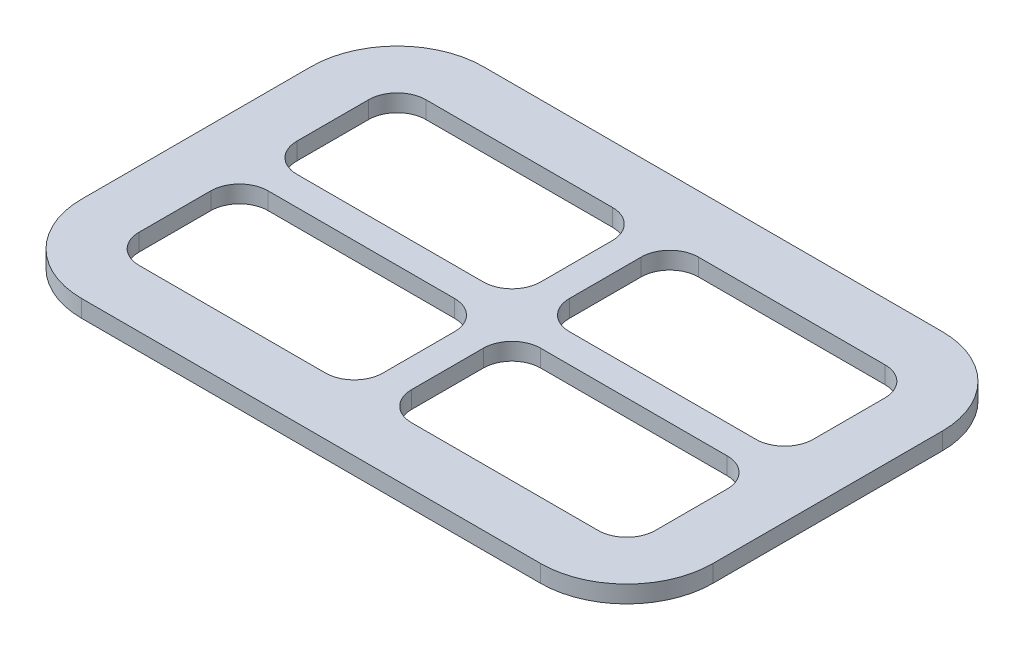
from build123d import *

# Parameters (mm, degrees)
ESBO_O1_W                = 220
ESBO_O1_H                = 140
RESSALTO_EXTRUS_O1_DEPTH = 6
ESBO_O2_W                = 85
ESBO_O2_H                = 45
CORTE_EXTRUS_O1_DEPTH    = 6
FILETE1_R                = 30
FILETE2_R                = 10


with BuildPart() as part:
    # Esboço1 → Ressalto-extrusão1 (new body)
    with BuildSketch(Plane(origin=(0, 0, 0), x_dir=(1, 0, 0), z_dir=(0, 1, 0))):
        Rectangle(ESBO_O1_W, ESBO_O1_H)
    extrude(amount=RESSALTO_EXTRUS_O1_DEPTH)

    # Esboço2 → Corte-extrusão1 (cut)
    with BuildSketch(Plane(origin=(0, 6, 0), x_dir=(1, 0, 0), z_dir=(0, 1, 0))):
        with Locations((47.5, 27.5)):
            Rectangle(ESBO_O2_W, ESBO_O2_H)
        with Locations((-47.5, 27.5)):
            Rectangle(ESBO_O2_W, ESBO_O2_H)
        with Locations((-47.5, -27.5)):
            Rectangle(ESBO_O2_W, ESBO_O2_H)
        with Locations((47.5, -27.5)):
            Rectangle(ESBO_O2_W, ESBO_O2_H)
    extrude(amount=-CORTE_EXTRUS_O1_DEPTH, mode=Mode.SUBTRACT)

    # Filete1
    filete1_edges = [part.edges().sort_by_distance(p)[0] for p in [
        (-110, 3, -70),
        (110, 3, -70),
        (110, 3, 70),
        (-110, 3, 70),
    ]]
    fillet(filete1_edges, radius=FILETE1_R)

    # Filete2
    filete2_edges = [part.edges().sort_by_distance(p)[0] for p in [
        (-90, 3, -50),
        (-5, 3, -50),
        (-5, 3, -5),
        (-90, 3, -5),
        (-90, 3, 50),
        (-90, 3, 5),
        (-5, 3, 5),
        (-5, 3, 50),
        (90, 3, 50),
        (5, 3, 50),
        (5, 3, 5),
        (90, 3, 5),
        (5, 3, -50),
        (90, 3, -50),
        (90, 3, -5),
        (5, 3, -5),
    ]]
    fillet(filete2_edges, radius=FILETE2_R)


solid = part.part
